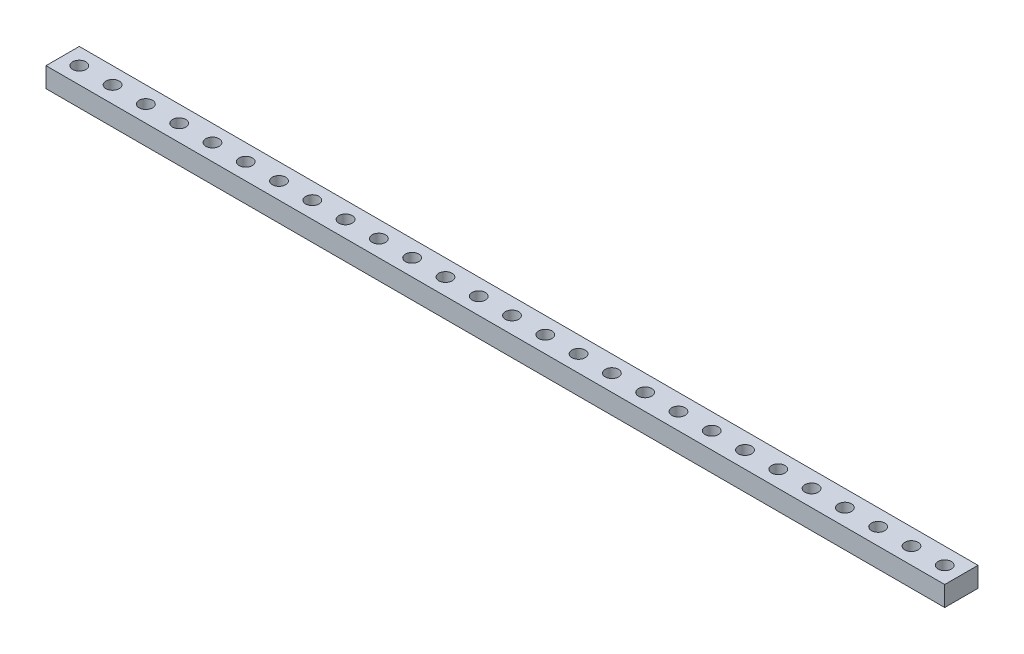
from build123d import *

# Parameters (mm, degrees)
ESQUISSE1_R             = 2
BOSS_EXTRU_1_DEPTH      = 6
ENL_V_MAT_EXTRU_1_REACH = 142.485
ESQUISSE2_W             = 10
ESQUISSE2_H             = 10


with BuildPart() as part:
    # Esquisse1 → Boss.-Extru.1 (new body)
    with BuildSketch(Plane(origin=(0, 0, 0), x_dir=(1, 0, 0), z_dir=(0, 1, 0))):
        Polygon((0, 0), (140, 0), (140, 10), (-140, 10), (-140, 0), align=None)
        with Locations(Location((-135, 5, 0), (0, 0, 270))):
            Circle(ESQUISSE1_R, mode=Mode.SUBTRACT)
        with Locations(Location((-125, 5, 0), (0, 0, 270))):
            Circle(ESQUISSE1_R, mode=Mode.SUBTRACT)
        with Locations(Location((-115, 5, 0), (0, 0, 270))):
            Circle(ESQUISSE1_R, mode=Mode.SUBTRACT)
        with Locations(Location((-105, 5, 0), (0, 0, 270))):
            Circle(ESQUISSE1_R, mode=Mode.SUBTRACT)
        with Locations(Location((-95, 5, 0), (0, 0, 270))):
            Circle(ESQUISSE1_R, mode=Mode.SUBTRACT)
        with Locations(Location((-85, 5, 0), (0, 0, 270))):
            Circle(ESQUISSE1_R, mode=Mode.SUBTRACT)
        with Locations(Location((-75, 5, 0), (0, 0, 270))):
            Circle(ESQUISSE1_R, mode=Mode.SUBTRACT)
        with Locations(Location((-65, 5, 0), (0, 0, 270))):
            Circle(ESQUISSE1_R, mode=Mode.SUBTRACT)
        with Locations(Location((-55, 5, 0), (0, 0, 270))):
            Circle(ESQUISSE1_R, mode=Mode.SUBTRACT)
        with Locations(Location((-45, 5, 0), (0, 0, 270))):
            Circle(ESQUISSE1_R, mode=Mode.SUBTRACT)
        with Locations(Location((-35, 5, 0), (0, 0, 270))):
            Circle(ESQUISSE1_R, mode=Mode.SUBTRACT)
        with Locations(Location((-25, 5, 0), (0, 0, 270))):
            Circle(ESQUISSE1_R, mode=Mode.SUBTRACT)
        with Locations(Location((-15, 5, 0), (0, 0, 270))):
            Circle(ESQUISSE1_R, mode=Mode.SUBTRACT)
        with Locations(Location((-5, 5, 0), (0, 0, 270))):
            Circle(ESQUISSE1_R, mode=Mode.SUBTRACT)
        with Locations(Location((5, 5, 0), (0, 0, 270))):
            Circle(ESQUISSE1_R, mode=Mode.SUBTRACT)
        with Locations(Location((15, 5, 0), (0, 0, 270))):
            Circle(ESQUISSE1_R, mode=Mode.SUBTRACT)
        with Locations(Location((25, 5, 0), (0, 0, 270))):
            Circle(ESQUISSE1_R, mode=Mode.SUBTRACT)
        with Locations(Location((35, 5, 0), (0, 0, 270))):
            Circle(ESQUISSE1_R, mode=Mode.SUBTRACT)
        with Locations(Location((45, 5, 0), (0, 0, 270))):
            Circle(ESQUISSE1_R, mode=Mode.SUBTRACT)
        with Locations(Location((55, 5, 0), (0, 0, 270))):
            Circle(ESQUISSE1_R, mode=Mode.SUBTRACT)
        with Locations(Location((65, 5, 0), (0, 0, 270))):
            Circle(ESQUISSE1_R, mode=Mode.SUBTRACT)
        with Locations(Location((75, 5, 0), (0, 0, 270))):
            Circle(ESQUISSE1_R, mode=Mode.SUBTRACT)
        with Locations(Location((85, 5, 0), (0, 0, 270))):
            Circle(ESQUISSE1_R, mode=Mode.SUBTRACT)
        with Locations(Location((95, 5, 0), (0, 0, 270))):
            Circle(ESQUISSE1_R, mode=Mode.SUBTRACT)
        with Locations(Location((105, 5, 0), (0, 0, 270))):
            Circle(ESQUISSE1_R, mode=Mode.SUBTRACT)
        with Locations(Location((115, 5, 0), (0, 0, 270))):
            Circle(ESQUISSE1_R, mode=Mode.SUBTRACT)
        with Locations(Location((125, 5, 0), (0, 0, 270))):
            Circle(ESQUISSE1_R, mode=Mode.SUBTRACT)
        with Locations(Location((135, 5, 0), (0, 0, 270))):
            Circle(ESQUISSE1_R, mode=Mode.SUBTRACT)
    extrude(amount=BOSS_EXTRU_1_DEPTH)

    # Esquisse2 → Enlèv. mat.-Extru.1 (cut, up to next)
    with BuildSketch(Plane(origin=(0, 6, 0), x_dir=(1, 0, 0), z_dir=(0, 1, 0)), mode=Mode.PRIVATE) as enl_v_mat_extru_1_sk1:
        with Locations((135, 5)):
            Rectangle(ESQUISSE2_W, ESQUISSE2_H)
    enl_v_mat_extru_1_tool1 = extrude(enl_v_mat_extru_1_sk1.sketch, amount=-ENL_V_MAT_EXTRU_1_REACH, mode=Mode.PRIVATE) & part.part
    add(enl_v_mat_extru_1_tool1.solids().sort_by_distance((135, 6, -5))[0], mode=Mode.SUBTRACT)


solid = part.part
